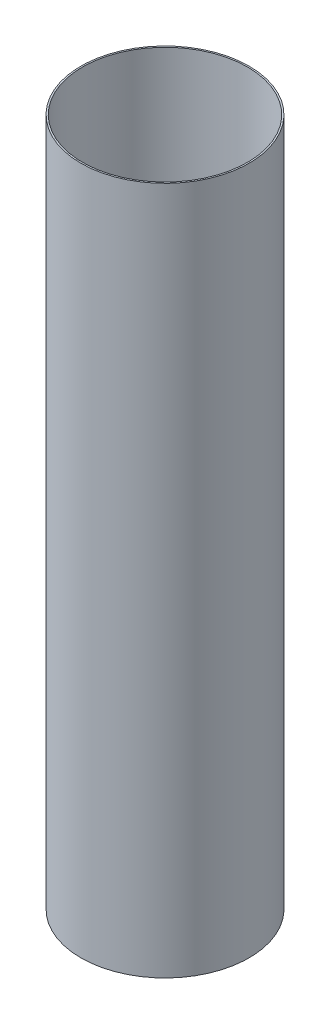
from build123d import *

# Parameters (mm, degrees)
SKETCH1_R           = 77.6224
SKETCH1_R_2         = 76.2
BOSS_EXTRUDE1_DEPTH = 317.5


with BuildPart() as part:
    # Sketch1 → Boss-Extrude1 (new, symmetric)
    with BuildSketch(Plane(origin=(0, 0, 0), x_dir=(1, 0, 0), z_dir=(0, 1, 0))):
        with Locations(Location((0, 0, 0), (0, 0, 90))):
            Circle(SKETCH1_R)
        with Locations(Location((0, 0, 0), (0, 0, 90))):
            Circle(SKETCH1_R_2, mode=Mode.SUBTRACT)
    extrude(amount=BOSS_EXTRUDE1_DEPTH, both=True)


solid = part.part
